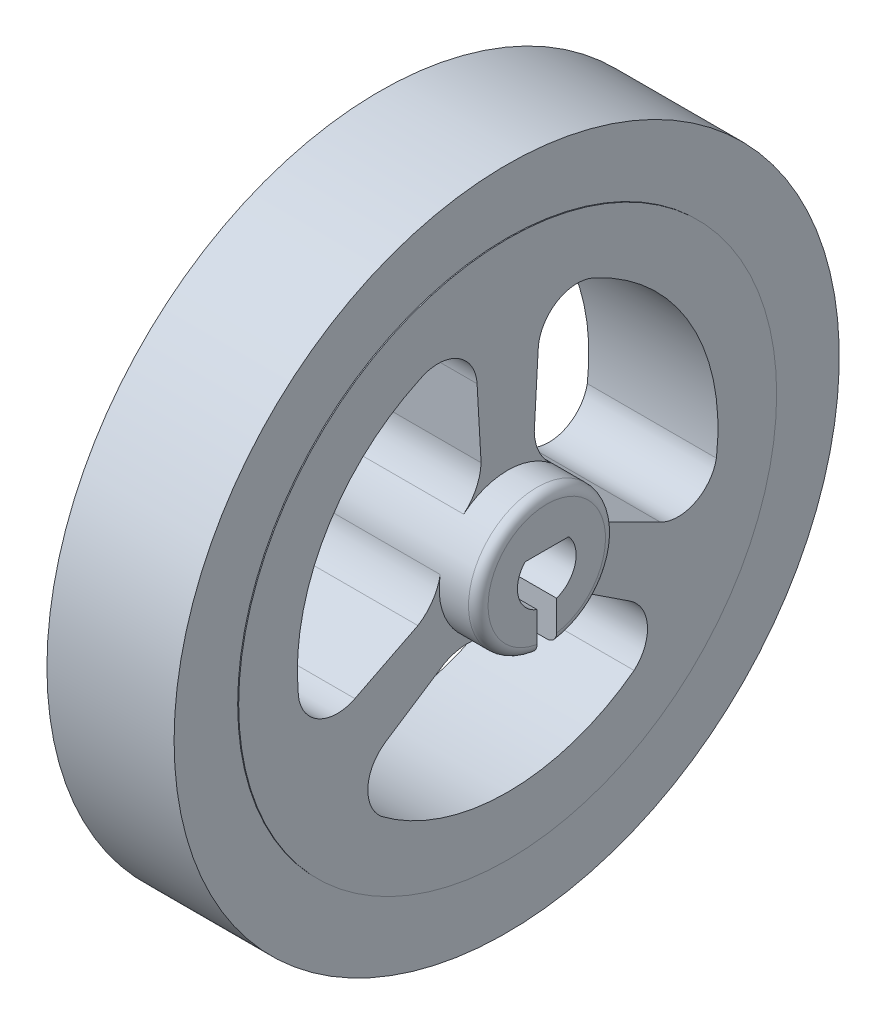
from build123d import *

# Parameters (mm, degrees)
RESSALTO_EXTRUS_O1_DEPTH      = 5.3
RESSALTO_EXTRUS_O1_DEPTH_BACK = 3.3
ESBO_O1_3_R                   = 13.75
RESSALTO_EXTRUS_O2_DEPTH      = 3.3
FILETE2_R                     = 0.5
ESBO_O2_R                     = 17
ESBO_O2_R_2                   = 13.75
RESSALTO_EXTRUS_O3_DEPTH      = 3.25


with BuildPart() as part:
    # Esboço1 → Ressalto-extrusão1 (new, two sides: drawn at the far end of the back side and taken through both)
    with BuildSketch(Plane(origin=(0, 0, 0), x_dir=(0, 0, -1), z_dir=(1, 0, 0)).offset(-RESSALTO_EXTRUS_O1_DEPTH_BACK)):
        with BuildLine():
            ThreePointArc((0.5, -1.414213562), (1.4531398, -0.37200097), (1.118033989, 1))
            Line((1.118033989, 1), (-1.118033989, 1))
            ThreePointArc((-1.118033989, 1), (-1.4531398, -0.37200097), (-0.5, -1.414213562))
            Line((-0.5, -1.414213562), (-0.5, -3.464101615))
            ThreePointArc((-0.5, -3.464101615), (0, 3.5), (0.5, -3.464101615))
            Line((0.5, -3.464101615), (0.5, -1.414213562))
        make_face()
    extrude(amount=RESSALTO_EXTRUS_O1_DEPTH + RESSALTO_EXTRUS_O1_DEPTH_BACK)

    # Esboço1<3> → Ressalto-extrusão2 (add, symmetric)
    with BuildSketch(Plane(origin=(0, 0, 0), x_dir=(0, 0, -1), z_dir=(1, 0, 0))):
        Circle(ESBO_O1_3_R)
        with BuildLine():
            ThreePointArc((3.446771953, 0.608081497), (3.031088913, -1.75), (1.196771953, -3.28903282))
            ThreePointArc((1.196771953, -3.28903282), (2.228560776, -3.144612223), (3.229618168, -3.433280857))
            Line((3.229618168, -3.433280857), (6.244929793, -5.410607922))
            ThreePointArc((6.244929793, -5.410607922), (7.143531761, -6.946693722), (6.462297299, -8.590763273))
            ThreePointArc((6.462297299, -8.590763273), (0, -10.75), (-6.462297299, -8.590763273))
            ThreePointArc((-6.462297299, -8.590763273), (-7.143531761, -6.946693722), (-6.244929793, -5.410607922))
            Line((-6.244929793, -5.410607922), (-3.229618168, -3.433280857))
            ThreePointArc((-3.229618168, -3.433280857), (-2.228560776, -3.144612223), (-1.196771953, -3.28903282))
            ThreePointArc((-1.196771953, -3.28903282), (-3.031088913, -1.75), (-3.446771953, 0.608081497))
            ThreePointArc((-3.446771953, 0.608081497), (-3.837594458, -0.357684134), (-4.588117525, -1.08029095))
            Line((-4.588117525, -1.08029095), (-7.808188807, -2.702963885))
            ThreePointArc((-7.808188807, -2.702963885), (-9.742921821, -2.628468224), (-10.707946608, -0.949936544))
            ThreePointArc((-10.707946608, -0.949936544), (-9.309773091, 5.375), (-4.531304125, 9.748322057))
            ThreePointArc((-4.531304125, 9.748322057), (-2.595140656, 9.751851916), (-1.563259014, 8.113571807))
            Line((-1.563259014, 8.113571807), (-1.358499357, 4.513571807))
            ThreePointArc((-1.358499357, 4.513571807), (-1.609033682, 3.502296357), (-2.25, 2.680951324))
            ThreePointArc((-2.25, 2.680951324), (0, 3.5), (2.25, 2.680951324))
            ThreePointArc((2.25, 2.680951324), (1.609033682, 3.502296357), (1.358499357, 4.513571807))
            Line((1.358499357, 4.513571807), (1.563259014, 8.113571807))
            ThreePointArc((1.563259014, 8.113571807), (2.595140656, 9.751851916), (4.531304125, 9.748322057))
            ThreePointArc((4.531304125, 9.748322057), (9.396801436, 5.221362156), (10.670967882, -1.301131991))
            ThreePointArc((10.670967882, -1.301131991), (9.587779116, -2.713133117), (7.808188807, -2.702963885))
            Line((7.808188807, -2.702963885), (4.588117525, -1.08029095))
            ThreePointArc((4.588117525, -1.08029095), (3.837594458, -0.357684134), (3.446771953, 0.608081497))
        make_face(mode=Mode.SUBTRACT)
    extrude(amount=RESSALTO_EXTRUS_O2_DEPTH, both=True)

    # Filete2
    filete2_edges = [part.edges().sort_by_distance(p)[0] for p in [
        (5.3, 3.5, 0),
    ]]
    fillet(filete2_edges, radius=FILETE2_R)

    # Esboço2 → Ressalto-extrusão3 (add, symmetric)
    with BuildSketch(Plane(origin=(0, 0, 0), x_dir=(0, 0, -1), z_dir=(1, 0, 0))):
        with Locations(Location((0, 0, 0), (0, 0, 180))):
            Circle(ESBO_O2_R)
        Circle(ESBO_O2_R_2, mode=Mode.SUBTRACT)
    extrude(amount=RESSALTO_EXTRUS_O3_DEPTH, both=True)


solid = part.part
